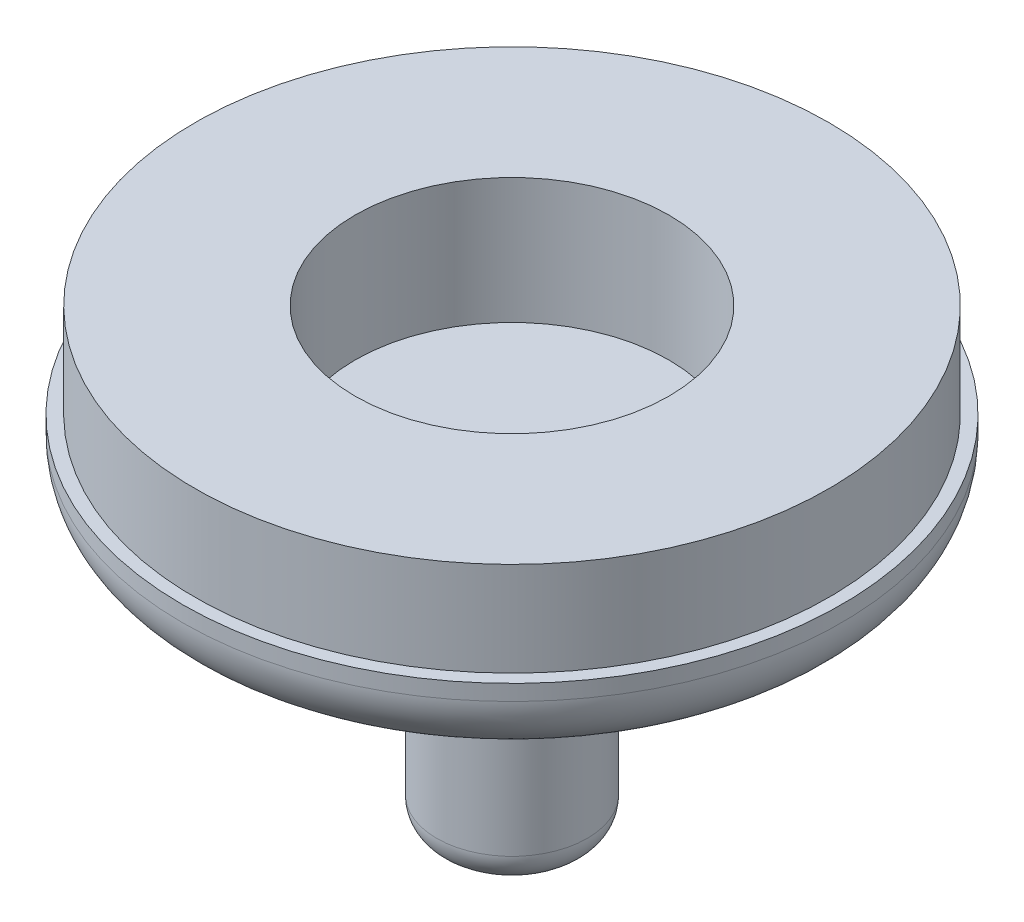
from build123d import *

# Parameters (mm, degrees)
SKETCH1_R           = 13.335
BOSS_EXTRUDE1_DEPTH = 3.175
SKETCH2_R           = 12.827
BOSS_EXTRUDE2_DEPTH = 3.81
SKETCH3_R           = 6.35
CUT_EXTRUDE2_DEPTH  = 5.08
FILLET1_R           = 2.54
SKETCH5_R           = 3.048
BOSS_EXTRUDE3_DEPTH = 11.43
FILLET2_R           = 1.27
FILLET3_R           = 1.27


with BuildPart() as part:
    # Sketch1 → Boss-Extrude1 (new body)
    with BuildSketch(Plane(origin=(0, 0, 0), x_dir=(1, 0, 0), z_dir=(0, 1, 0))):
        Circle(SKETCH1_R)
    extrude(amount=BOSS_EXTRUDE1_DEPTH)

    # Sketch2 → Boss-Extrude2 (add)
    with BuildSketch(Plane(origin=(0, 3.175, 0), x_dir=(1, 0, 0), z_dir=(0, 1, 0))):
        Circle(SKETCH2_R)
    extrude(amount=BOSS_EXTRUDE2_DEPTH)

    # Sketch3 → Cut-Extrude2 (cut)
    with BuildSketch(Plane(origin=(0, 6.985, 0), x_dir=(1, 0, 0), z_dir=(0, 1, 0))):
        Circle(SKETCH3_R)
    extrude(amount=-CUT_EXTRUDE2_DEPTH, mode=Mode.SUBTRACT)

    # Fillet1
    fillet1_edges = [part.edges().sort_by_distance(p)[0] for p in [
        (-13.335, 0, 0),
    ]]
    fillet(fillet1_edges, radius=FILLET1_R)

    # Sketch5 → Boss-Extrude3 (add)
    with BuildSketch(Plane.XZ):
        Circle(SKETCH5_R)
    extrude(amount=BOSS_EXTRUDE3_DEPTH)

    # Fillet2
    fillet2_edges = [part.edges().sort_by_distance(p)[0] for p in [
        (-3.048, -11.43, 0),
    ]]
    fillet(fillet2_edges, radius=FILLET2_R)

    # Fillet3
    fillet3_edges = [part.edges().sort_by_distance(p)[0] for p in [
        (-3.048, 0, 0),
    ]]
    fillet(fillet3_edges, radius=FILLET3_R)


solid = part.part
